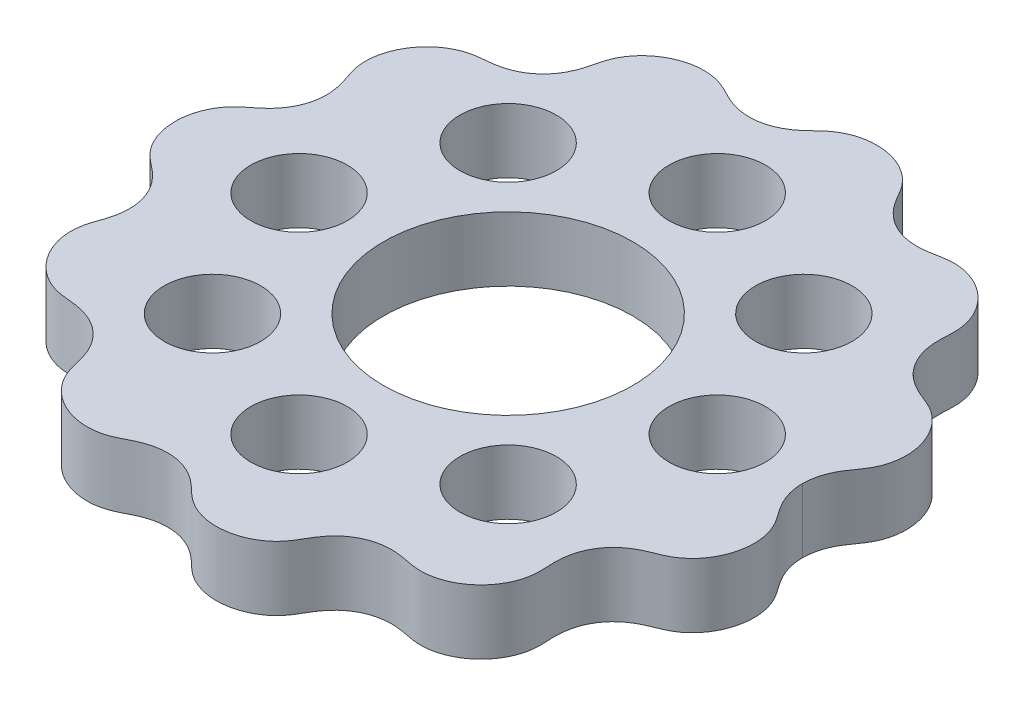
from build123d import *

# Parameters (mm, degrees)
SKETCH5_R           = 7.75
SKETCH5_R_2         = 3
BOSS_EXTRUDE1_DEPTH = 4


with BuildPart() as part:
    # Sketch5 → Boss-Extrude1 (new body)
    with BuildSketch(Plane(origin=(0, 0, 0), x_dir=(1, 0, 0), z_dir=(0, 1, 0))):
        with BuildLine():
            add(Edge.make_bspline(
                [(18.300001887, 0), (18.300010705, 0.215003642), (18.338753267, 0.679195711), (18.481842575, 1.210321363), (18.761018022, 1.769953886), (19.026922674, 2.177839709), (19.210941823, 2.435719572), (19.395680187, 2.692915456), (19.565636036, 2.960653153), (19.747906504, 3.312651466), (19.93864247, 3.834129911), (20.057403353, 4.540200664), (20.008357851, 5.405300521), (19.73988768, 6.299853158), (19.316404426, 7.035503992), (18.804461721, 7.597715814), (18.252322537, 8.001873087), (17.702817336, 8.258330995), (17.045959095, 8.495881339), (16.33809985, 8.864560366), (15.653899025, 9.450547644), (15.111166239, 10.288642285), (14.875683836, 11.0799767), (14.822703851, 11.725063966), (14.833067746, 12.274681518), (14.865342292, 12.727729927), (14.862671279, 13.260106684), (14.72837929, 13.933027823), (14.431180013, 14.635872275), (13.939794383, 15.329319559), (13.239260177, 15.947255395), (12.47536717, 16.35313672), (11.786732938, 16.540778236), (11.235218742, 16.586678139), (10.840465401, 16.56940856), (10.527116328, 16.527762316), (10.217294205, 16.467397556), (9.907369576, 16.40679263), (9.427779331, 16.332618687), (8.77060888, 16.305817429), (7.952186843, 16.4461635), (7.05753878, 16.886576705), (6.397338254, 17.492264381), (5.948604744, 18.14195596), (5.624727499, 18.753013498), (5.285770723, 19.249160517), (4.804691328, 19.725693077), (4.176014993, 20.140002558), (3.402438751, 20.439804509), (2.508657291, 20.56999395), (1.692711777, 20.503894327), (0.991598744, 20.296000008), (0.418872155, 19.998006776), (-0.02725181, 19.65754733), (-0.414581276, 19.267445025), (-0.814528019, 18.90348851), (-1.247986951, 18.593547535), (-1.711920278, 18.350461041), (-2.319399601, 18.138711547), (-3.078163454, 18.033252029), (-3.792383587, 18.109977363), (-4.419089964, 18.317056401), (-4.860951124, 18.522055264), (-5.142543266, 18.667497448), (-5.423490802, 18.813876291), (-5.712723674, 18.944234753), (-6.087139526, 19.074870645), (-6.630597424, 19.189860926), (-7.346667059, 19.20731203), (-8.196213037, 19.035978551), (-9.043604624, 18.643233497), (-9.711585586, 18.119766073), (-10.195342802, 17.53348167), (-10.517068924, 16.929963942), (-10.693108972, 16.349784917), (-10.834609167, 15.666278533), (-11.098084342, 14.912944072), (-11.580219609, 14.152147896), (-12.332698376, 13.493485596), (-13.154045362, 13.115864382), (-13.942503997, 12.956008438), (-14.645194298, 12.912269275), (-15.250766145, 12.822594904), (-15.897472911, 12.590223912), (-16.54739671, 12.195763284), (-17.160036154, 11.61172513), (-17.669121957, 10.834355582), (-17.961644901, 10.022765221), (-18.049722961, 9.314879519), (-18.017041175, 8.762586144), (-17.944075374, 8.374451054), (-17.858487142, 8.070258258), (-17.754769799, 7.772289566), (-17.650656333, 7.474276115), (-17.50880783, 7.010389693), (-17.388284102, 6.364073981), (-17.409918688, 5.53414754), (-17.717528668, 4.585603708), (-18.222482128, 3.845315705), (-18.801533842, 3.307998155), (-19.360494017, 2.900260179), (-19.803886321, 2.494354237), (-20.207639479, 1.950362105), (-20.529511005, 1.267444047), (-20.665736565, 0.676951062), (-20.699969648, 0.226217639), (-20.699980788, 0)],
                knots=[0.141360251, 0.141360251, 0.141360251, 0.141360251, 0.141360251, 0.147176466, 0.153918094, 0.156060029, 0.158201964, 0.160343899, 0.162485834, 0.164627769, 0.166769704, 0.171053574, 0.177448288, 0.183843002, 0.189974304, 0.196105605, 0.200190466, 0.204275326, 0.208360186, 0.212445047, 0.219092122, 0.225739198, 0.232410023, 0.239080848, 0.241129578, 0.243178308, 0.247275769, 0.251373229, 0.255470689, 0.26162196, 0.267773231, 0.274147854, 0.280522477, 0.284792468, 0.286927463, 0.289062458, 0.291197453, 0.293332448, 0.295467443, 0.297602438, 0.304323247, 0.311044057, 0.317624667, 0.324205277, 0.32825003, 0.332294783, 0.336339536, 0.34038429, 0.34645539, 0.35252649, 0.358575019, 0.364623549, 0.368400769, 0.372177989, 0.375955209, 0.379732429, 0.383262932, 0.386793435, 0.390323938, 0.393854441, 0.400598657, 0.407342873, 0.409485678, 0.411628483, 0.413771288, 0.415914094, 0.418056899, 0.420199704, 0.424485315, 0.430882535, 0.437279755, 0.443408557, 0.44953736, 0.453620655, 0.457703951, 0.461787247, 0.465870543, 0.472514633, 0.479158722, 0.485845752, 0.492532781, 0.496656173, 0.500779565, 0.504902957, 0.509026349, 0.515118169, 0.521209989, 0.527582095, 0.533954202, 0.538222463, 0.540356594, 0.542490724, 0.544624855, 0.546758986, 0.548893116, 0.551027247, 0.557745439, 0.564463631, 0.571046705, 0.577629779, 0.581676342, 0.585722905, 0.589769469, 0.593816032, 0.59988964, 0.606009754, 0.606009754, 0.606009754, 0.606009754, 0.606009754], degree=4))
            add(Edge.make_bspline(
                [(18.300001887, 0), (18.300010705, -0.215003642), (18.338753267, -0.679195711), (18.481842575, -1.210321363), (18.761018022, -1.769953886), (19.026922674, -2.177839709), (19.210941823, -2.435719572), (19.395680187, -2.692915456), (19.565636036, -2.960653153), (19.747906504, -3.312651466), (19.93864247, -3.834129911), (20.057403353, -4.540200664), (20.008357851, -5.405300521), (19.73988768, -6.299853158), (19.316404426, -7.035503991), (18.804461721, -7.597715814), (18.252322537, -8.001873087), (17.702817336, -8.258330995), (17.045959095, -8.495881339), (16.33809985, -8.864560366), (15.653899025, -9.450547644), (15.111166239, -10.288642285), (14.875683836, -11.0799767), (14.822703851, -11.725063966), (14.833067746, -12.274681518), (14.865342292, -12.727729927), (14.862671279, -13.260106684), (14.72837929, -13.933027823), (14.431180013, -14.635872275), (13.939794383, -15.329319559), (13.239260177, -15.947255395), (12.47536717, -16.35313672), (11.786732938, -16.540778236), (11.235218742, -16.586678139), (10.840465401, -16.56940856), (10.527116328, -16.527762316), (10.217294205, -16.467397556), (9.907369576, -16.40679263), (9.427779331, -16.332618687), (8.77060888, -16.305817429), (7.952186843, -16.4461635), (7.05753878, -16.886576705), (6.397338254, -17.492264381), (5.948604744, -18.14195596), (5.624727499, -18.753013498), (5.285770723, -19.249160517), (4.804691328, -19.725693077), (4.176014993, -20.140002558), (3.402438751, -20.439804509), (2.508657291, -20.56999395), (1.692711777, -20.503894327), (0.991598744, -20.296000008), (0.418872155, -19.998006776), (-0.02725181, -19.65754733), (-0.414581276, -19.267445025), (-0.814528019, -18.90348851), (-1.247986951, -18.593547535), (-1.711920278, -18.350461041), (-2.319399601, -18.138711547), (-3.078163454, -18.033252029), (-3.792383587, -18.109977363), (-4.419089964, -18.317056401), (-4.860951124, -18.522055264), (-5.142543266, -18.667497448), (-5.423490802, -18.813876291), (-5.712723674, -18.944234753), (-6.087139526, -19.074870645), (-6.630597424, -19.189860926), (-7.346667059, -19.20731203), (-8.196213037, -19.035978551), (-9.043604624, -18.643233497), (-9.711585586, -18.119766073), (-10.195342802, -17.53348167), (-10.517068924, -16.929963942), (-10.693108972, -16.349784917), (-10.834609167, -15.666278533), (-11.098084342, -14.912944072), (-11.580219609, -14.152147896), (-12.332698376, -13.493485596), (-13.154045362, -13.115864382), (-13.942503997, -12.956008438), (-14.645194298, -12.912269275), (-15.250766145, -12.822594904), (-15.897472911, -12.590223912), (-16.54739671, -12.195763284), (-17.160036154, -11.61172513), (-17.669121957, -10.834355582), (-17.961644901, -10.022765221), (-18.049722961, -9.314879519), (-18.017041175, -8.762586144), (-17.944075374, -8.374451054), (-17.858487142, -8.070258258), (-17.754769799, -7.772289566), (-17.650656333, -7.474276115), (-17.50880783, -7.010389693), (-17.388284102, -6.364073981), (-17.409918688, -5.53414754), (-17.717528668, -4.585603708), (-18.222482128, -3.845315705), (-18.801533842, -3.307998155), (-19.360494017, -2.900260179), (-19.803886321, -2.494354237), (-20.207639479, -1.950362105), (-20.529511005, -1.267444047), (-20.665736565, -0.676951062), (-20.699969648, -0.226217639), (-20.699980788, 0)],
                knots=[0.141360251, 0.141360251, 0.141360251, 0.141360251, 0.141360251, 0.147176466, 0.153918094, 0.156060029, 0.158201964, 0.160343899, 0.162485834, 0.164627769, 0.166769704, 0.171053574, 0.177448288, 0.183843002, 0.189974304, 0.196105605, 0.200190466, 0.204275326, 0.208360186, 0.212445047, 0.219092122, 0.225739198, 0.232410023, 0.239080848, 0.241129578, 0.243178308, 0.247275769, 0.251373229, 0.255470689, 0.26162196, 0.267773231, 0.274147854, 0.280522477, 0.284792468, 0.286927463, 0.289062458, 0.291197453, 0.293332448, 0.295467443, 0.297602438, 0.304323247, 0.311044057, 0.317624667, 0.324205277, 0.32825003, 0.332294783, 0.336339536, 0.34038429, 0.34645539, 0.35252649, 0.358575019, 0.364623549, 0.368400769, 0.372177989, 0.375955209, 0.379732429, 0.383262932, 0.386793435, 0.390323938, 0.393854441, 0.400598657, 0.407342873, 0.409485678, 0.411628483, 0.413771288, 0.415914094, 0.418056899, 0.420199704, 0.424485315, 0.430882535, 0.437279755, 0.443408557, 0.44953736, 0.453620655, 0.457703951, 0.461787247, 0.465870543, 0.472514633, 0.479158722, 0.485845752, 0.492532781, 0.496656173, 0.500779565, 0.504902957, 0.509026349, 0.515118169, 0.521209989, 0.527582095, 0.533954202, 0.538222463, 0.540356594, 0.542490724, 0.544624855, 0.546758986, 0.548893116, 0.551027247, 0.557745439, 0.564463631, 0.571046705, 0.577629779, 0.581676342, 0.585722905, 0.589769469, 0.593816032, 0.59988964, 0.606009754, 0.606009754, 0.606009754, 0.606009754, 0.606009754], degree=4))
        make_face()
        with Locations(Location((0, 0, 0), (0, 0, 270))):
            Circle(SKETCH5_R, mode=Mode.SUBTRACT)
        with Locations(Location((-9.192388155, -9.192388155, 0), (0, 0, 270))):
            Circle(SKETCH5_R_2, mode=Mode.SUBTRACT)
        with Locations(Location((0, -13, 0), (0, 0, 270))):
            Circle(SKETCH5_R_2, mode=Mode.SUBTRACT)
        with Locations(Location((9.192388155, -9.192388155, 0), (0, 0, 270))):
            Circle(SKETCH5_R_2, mode=Mode.SUBTRACT)
        with Locations(Location((13, 0, 0), (0, 0, 270))):
            Circle(SKETCH5_R_2, mode=Mode.SUBTRACT)
        with Locations(Location((9.192388155, 9.192388155, 0), (0, 0, 270))):
            Circle(SKETCH5_R_2, mode=Mode.SUBTRACT)
        with Locations(Location((0, 13, 0), (0, 0, 270))):
            Circle(SKETCH5_R_2, mode=Mode.SUBTRACT)
        with Locations(Location((-9.192388155, 9.192388155, 0), (0, 0, 270))):
            Circle(SKETCH5_R_2, mode=Mode.SUBTRACT)
        with Locations(Location((-13, 0, 0), (0, 0, 270))):
            Circle(SKETCH5_R_2, mode=Mode.SUBTRACT)
    extrude(amount=BOSS_EXTRUDE1_DEPTH)


solid = part.part
